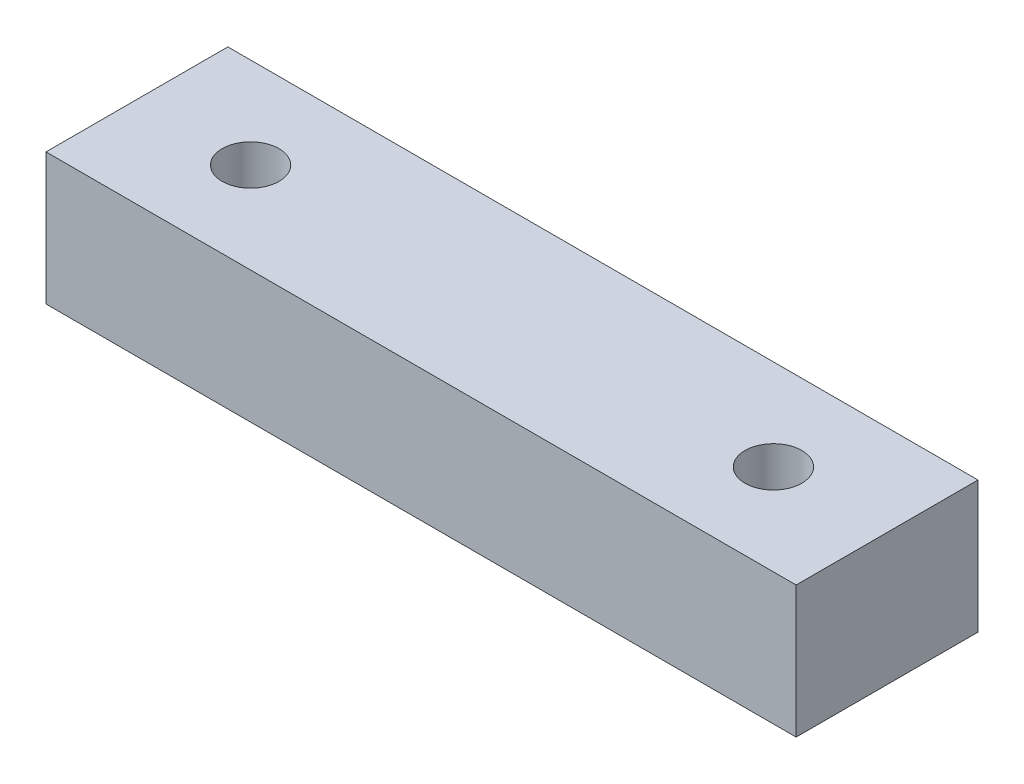
from build123d import *

# Parameters (mm, degrees)
SKETCH1_W           = 83.82
SKETCH1_H           = 20.32
SKETCH1_R           = 3.175
BOSS_EXTRUDE1_DEPTH = 14.722475


with BuildPart() as part:
    # Sketch1 → Boss-Extrude1 (new body)
    with BuildSketch(Plane(origin=(0, 0, 0), x_dir=(1, 0, 0), z_dir=(0, 1, 0))):
        Rectangle(SKETCH1_W, SKETCH1_H)
        with Locations(Location((-29.21, 0, 0), (0, 0, 270))):
            Circle(SKETCH1_R, mode=Mode.SUBTRACT)
        with Locations(Location((29.21, 0, 0), (0, 0, 270))):
            Circle(SKETCH1_R, mode=Mode.SUBTRACT)
    extrude(amount=BOSS_EXTRUDE1_DEPTH)


solid = part.part
